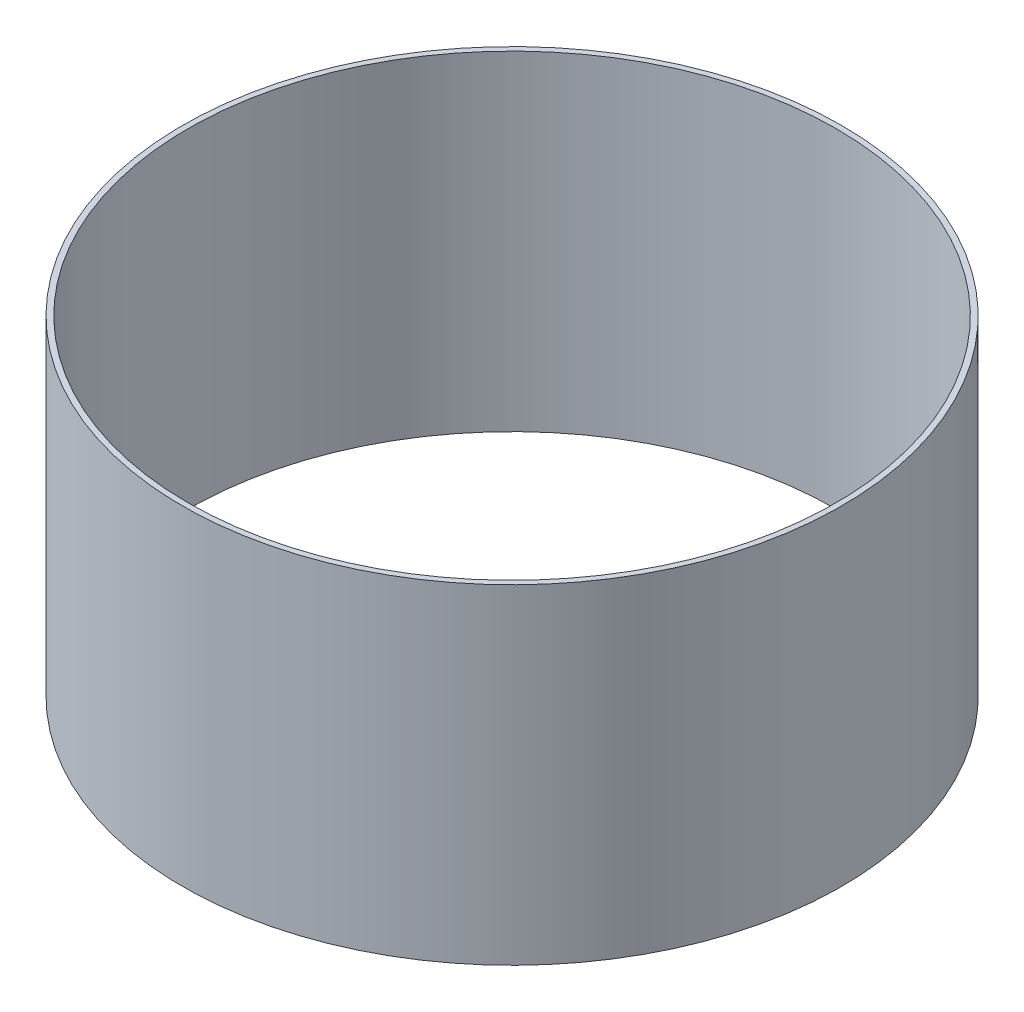
from build123d import *

# Parameters (mm, degrees)
SKETCH2_R           = 76.2
SKETCH2_R_2         = 74.93
BOSS_EXTRUDE1_DEPTH = 76.2


with BuildPart() as part:
    # Sketch2 → Boss-Extrude1 (new body)
    with BuildSketch(Plane(origin=(0, 0, 0), x_dir=(1, 0, 0), z_dir=(0, 1, 0))):
        with Locations(Location((0, 0, 0), (0, 0, 90))):
            Circle(SKETCH2_R)
        with Locations(Location((0, 0, 0), (0, 0, 90))):
            Circle(SKETCH2_R_2, mode=Mode.SUBTRACT)
    extrude(amount=BOSS_EXTRUDE1_DEPTH)


solid = part.part
